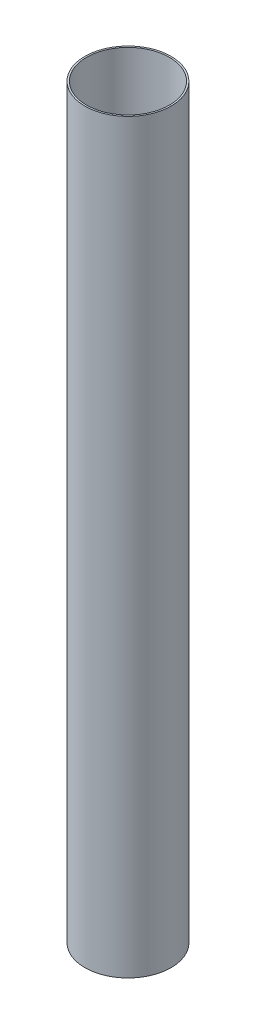
from build123d import *

# Parameters (mm, degrees)
SKETCH1_R           = 39.624
SKETCH1_R_2         = 38.1
BOSS_EXTRUDE1_DEPTH = 685.8


with BuildPart() as part:
    # Sketch1 → Boss-Extrude1 (new body)
    with BuildSketch(Plane(origin=(0, 0, 0), x_dir=(1, 0, 0), z_dir=(0, 1, 0))):
        with Locations(Location((0, 0, 0), (0, 0, 270))):
            Circle(SKETCH1_R)
        with Locations(Location((0, 0, 0), (0, 0, 270))):
            Circle(SKETCH1_R_2, mode=Mode.SUBTRACT)
    extrude(amount=BOSS_EXTRUDE1_DEPTH)


solid = part.part
